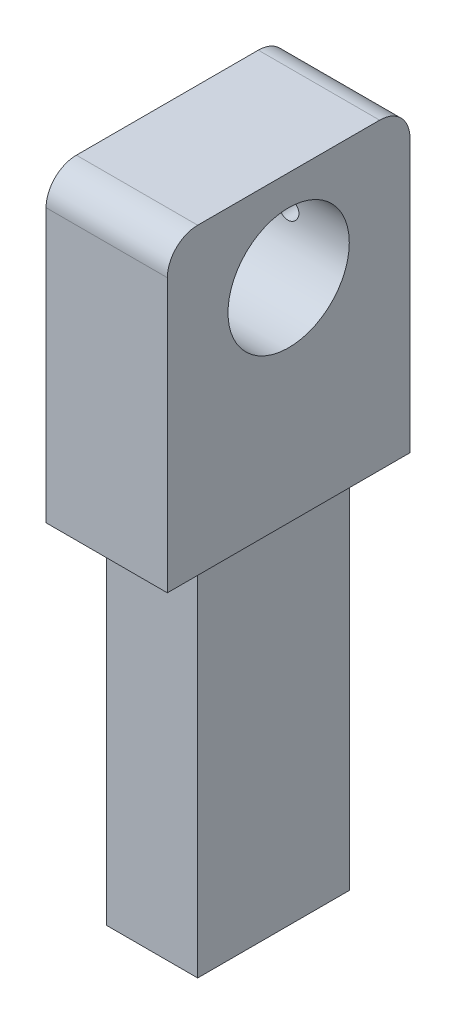
from build123d import *

# Parameters (mm, degrees)
SKETCH2_W               = 19.05
SKETCH2_H               = 31.75
BOSS_EXTRUDE1_DEPTH     = 76.2
SKETCH3_W               = 25.4
SKETCH3_H               = 50.8
BOSS_EXTRUDE2_DEPTH     = 63.5
FILLET1_R               = 6.35
SKETCH4_R               = 12.7
CUT_EXTRUDE1_DEPTH      = 145.244271983
CUT_EXTRUDE2_REACH      = 151.191
CUT_EXTRUDE2_END_RADIUS = 12.7
SKETCH5_R               = 2.15265


with BuildPart() as part:
    # Sketch2 → Boss-Extrude1 (new body)
    with BuildSketch(Plane(origin=(0, 0, 0), x_dir=(1, 0, 0), z_dir=(0, 1, 0))):
        Rectangle(SKETCH2_W, SKETCH2_H)
    extrude(amount=BOSS_EXTRUDE1_DEPTH)

    # Sketch3 → Boss-Extrude2 (add)
    with BuildSketch(Plane(origin=(0, 76.2, 0), x_dir=(1, 0, 0), z_dir=(0, 1, 0))):
        Rectangle(SKETCH3_W, SKETCH3_H)
    extrude(amount=BOSS_EXTRUDE2_DEPTH)

    # Fillet1
    fillet1_edges = [part.edges().sort_by_distance(p)[0] for p in [
        (0, 139.7, -25.4),
        (0, 139.7, 25.4),
    ]]
    fillet(fillet1_edges, radius=FILLET1_R)

    # Sketch4 → Cut-Extrude1 (cut, through all)
    with BuildSketch(Plane(origin=(12.7, 0, 0), x_dir=(0, 0, -1), z_dir=(1, 0, 0))):
        with Locations((0, 120.65)):
            Circle(SKETCH4_R)
    extrude(amount=-CUT_EXTRUDE1_DEPTH, mode=Mode.SUBTRACT)

    # Cut-Extrude2: up to this cylinder (the profile starts outside it)
    cut_extrude2_end = Plane(origin=(0, 120.65, 0), z_dir=(1, 0, 0)) * Cylinder(CUT_EXTRUDE2_END_RADIUS, 328.782, mode=Mode.PRIVATE)
    # Sketch5 → Cut-Extrude2 (cut, up to the surface)
    with BuildSketch(Plane(origin=(0, 0, -25.4), x_dir=(-1, 0, 0), z_dir=(0, 0, -1)), mode=Mode.PRIVATE) as cut_extrude2_sk1:
        with Locations((0, 120.65)):
            Circle(SKETCH5_R)
    cut_extrude2_tool1 = extrude(cut_extrude2_sk1.sketch, amount=-CUT_EXTRUDE2_REACH, mode=Mode.PRIVATE) - cut_extrude2_end
    add(cut_extrude2_tool1.solids().sort_by_distance((0, 120.65, -25.4))[0], mode=Mode.SUBTRACT)


solid = part.part
